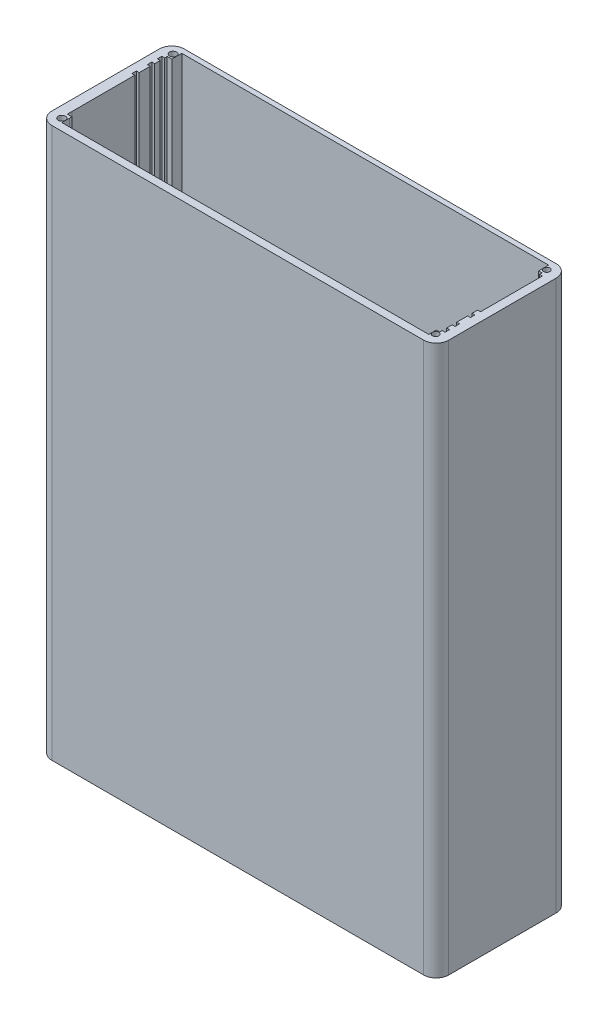
from build123d import *

# Parameters (mm, degrees)
SKETCH1_W           = 158.8
SKETCH1_H           = 53
SKETCH1_R           = 1.4
SKETCH1_R_2         = 1.25
SKETCH1_R_3         = 1.45
BOSS_EXTRUDE1_DEPTH = 220
FILLET1_R           = 5
FILLET2_R           = 5
FILLET3_R           = 5
FILLET4_R           = 5


with BuildPart() as part:
    # Sketch1 → Boss-Extrude1 (new body)
    with BuildSketch(Plane(origin=(0, 0, 0), x_dir=(1, 0, 0), z_dir=(0, 1, 0))):
        with Locations((-25.778590477, -11.5)):
            Rectangle(SKETCH1_W, SKETCH1_H)
        with Locations(Location((-100.664295238, 11, 0), (0, 0, 270))):
            Circle(SKETCH1_R, mode=Mode.SUBTRACT)
        with Locations(Location((48.885704762, 11, 0), (0, 0, 270))):
            Circle(SKETCH1_R_2, mode=Mode.SUBTRACT)
        with Locations(Location((-100.664295238, -33.5, 0), (0, 0, 270))):
            Circle(SKETCH1_R_3, mode=Mode.SUBTRACT)
        with Locations(Location((48.885704762, -33.5, 0), (0, 0, 270))):
            Circle(SKETCH1_R_2, mode=Mode.SUBTRACT)
        Polygon((49, -31), (49, -32), (47.621409523, -32), (47.621409523, -35), (-99.178590477, -35), (-99.178590477, -32), (-99.186141089, -32), (-99.186141089, -31), (-101.006752445, -31), (-101.006752445, -29.2), (-100.997355004, -29.2), (-100.997355004, -4), (-102.15, -4), (-102.15, -2.2), (-101, -2.2), (-101, 2.2), (-102.15, 2.2), (-102.15, 4), (-101, 4), (-101, 6.2), (-102.15, 6.2), (-102.15, 8), (-101, 8), (-101, 9), (-99.178590477, 9), (-99.178590477, 13), (47.621409523, 13), (47.621409523, 9), (49, 9), (49, 8), (50.15, 8), (50.15, -16.8), (49, -16.8), (49, -19), (50.15, -19), (50.15, -20.8), (49, -20.8), (49, -25.2), (50.15, -25.2), (50.15, -27), (49, -27), (49, -29.2), (50.15, -29.2), (50.15, -31), align=None, mode=Mode.SUBTRACT)
    extrude(amount=BOSS_EXTRUDE1_DEPTH)

    # Fillet1
    fillet1_edges = [part.edges().sort_by_distance(p)[0] for p in [
        (-105.178590477, 110, -15),
    ]]
    fillet(fillet1_edges, radius=FILLET1_R)

    # Fillet2
    fillet2_edges = [part.edges().sort_by_distance(p)[0] for p in [
        (-105.178590477, 110, 38),
    ]]
    fillet(fillet2_edges, radius=FILLET2_R)

    # Fillet3
    fillet3_edges = [part.edges().sort_by_distance(p)[0] for p in [
        (53.621409523, 110, -15),
    ]]
    fillet(fillet3_edges, radius=FILLET3_R)

    # Fillet4
    fillet4_edges = [part.edges().sort_by_distance(p)[0] for p in [
        (53.621409523, 110, 38),
    ]]
    fillet(fillet4_edges, radius=FILLET4_R)


solid = part.part
